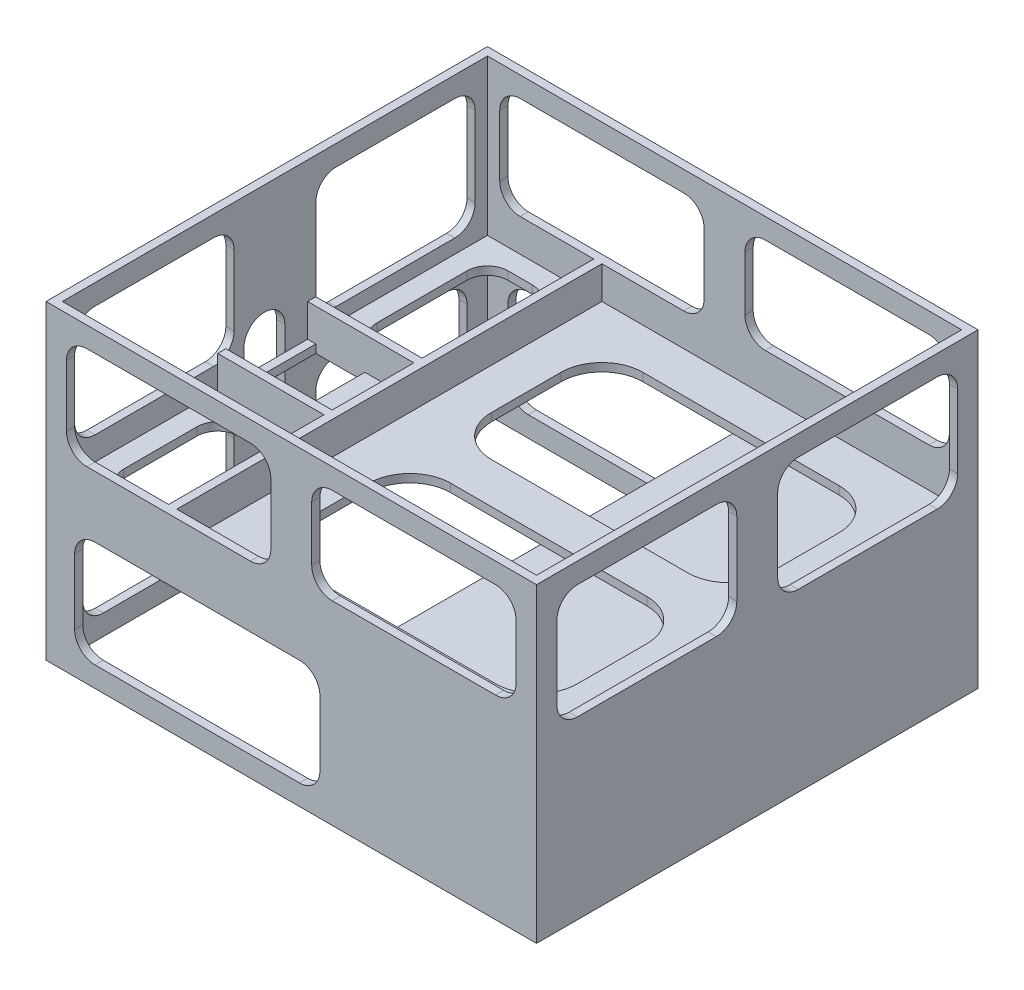
from build123d import *

# Parameters (mm, degrees)
SKETCH1_W                = 60
SKETCH1_H                = 54
BOSS_EXTRUDE1_DEPTH      = 38
SKETCH2_W                = 44
SKETCH2_H                = 52
CUT_EXTRUDE1_DEPTH       = 19
SKETCH3_W                = 35
SKETCH3_H                = 52
CUT_EXTRUDE2_DEPTH       = 18
SKETCH4_W                = 6
SKETCH4_H                = 10
CUT_EXTRUDE3_DEPTH       = 38
SKETCH5_W                = 14
SKETCH5_H                = 52
CUT_EXTRUDE5_DEPTH       = 15
SKETCH6_W                = 13
SKETCH6_H                = 52
CUT_EXTRUDE6_DEPTH       = 4
SKETCH8_W                = 15
SKETCH8_H                = 13
CUT_EXTRUDE7_DEPTH       = 6
SKETCH10_W               = 13
SKETCH10_H               = 5
CUT_EXTRUDE8_DEPTH       = 6
SKETCH11_W               = 4
SKETCH11_H               = 5
CUT_EXTRUDE9_DEPTH       = 3
SKETCH12_W               = 5
SKETCH12_H               = 2
CUT_EXTRUDE10_DEPTH      = 13
CUT_EXTRUDE11_DEPTH      = 1
SKETCH14_W               = 13
SKETCH14_H               = 1
BOSS_EXTRUDE2_DEPTH      = 4
SKETCH15_W               = 13
SKETCH15_H               = 1
BOSS_EXTRUDE3_DEPTH      = 4
CUT_EXTRUDE12_DEPTH      = 1
CUT_EXTRUDE13_DEPTH      = 1
CUT_EXTRUDE14_DEPTH      = 1
CUT_EXTRUDE15_DEPTH      = 60
CUT_EXTRUDE16_START      = -1
CUT_EXTRUDE16_DEPTH      = 1
CUT_EXTRUDE17_DEPTH      = 100
CUT_EXTRUDE17_DEPTH_BACK = 10
CUT_EXTRUDE18_DEPTH      = 10


with BuildPart() as part:
    # Sketch1 → Boss-Extrude1 (new body)
    with BuildSketch(Plane(origin=(0, 0, 0), x_dir=(1, 0, 0), z_dir=(0, 1, 0))):
        with Locations((-83.874465942, -33.946435202)):
            Rectangle(SKETCH1_W, SKETCH1_H)
    extrude(amount=BOSS_EXTRUDE1_DEPTH)

    # Sketch2 → Cut-Extrude1 (cut)
    with BuildSketch(Plane(origin=(0, 38, 0), x_dir=(1, 0, 0), z_dir=(0, 1, 0))):
        with Locations((-76.874465942, -33.946435202)):
            Rectangle(SKETCH2_W, SKETCH2_H)
    extrude(amount=-CUT_EXTRUDE1_DEPTH, mode=Mode.SUBTRACT)

    # Sketch3 → Cut-Extrude2 (cut)
    with BuildSketch(Plane(origin=(0, 0, 0), x_dir=(-1, 0, 0), z_dir=(0, -1, 0))):
        with Locations((95.374465942, -33.946435202)):
            Rectangle(SKETCH3_W, SKETCH3_H)
    extrude(amount=-CUT_EXTRUDE2_DEPTH, mode=Mode.SUBTRACT)

    # Sketch4 → Cut-Extrude3 (cut)
    with BuildSketch(Plane(origin=(0, 18, 0), x_dir=(-1, 0, 0), z_dir=(0, -1, 0))):
        with Locations((108.874465942, -34.946435202)):
            Rectangle(SKETCH4_W, SKETCH4_H)
    extrude(amount=-CUT_EXTRUDE3_DEPTH, mode=Mode.SUBTRACT)

    # Sketch5 → Cut-Extrude5 (cut)
    with BuildSketch(Plane(origin=(0, 38, 0), x_dir=(1, 0, 0), z_dir=(0, 1, 0))):
        with Locations((-105.874465942, -33.946435202)):
            Rectangle(SKETCH5_W, SKETCH5_H)
    extrude(amount=-CUT_EXTRUDE5_DEPTH, mode=Mode.SUBTRACT)

    # Sketch6 → Cut-Extrude6 (cut)
    with BuildSketch(Plane(origin=(0, 23, 0), x_dir=(1, 0, 0), z_dir=(0, 1, 0))):
        with Locations((-106.374465942, -33.946435202)):
            Rectangle(SKETCH6_W, SKETCH6_H)
    extrude(amount=-CUT_EXTRUDE6_DEPTH, mode=Mode.SUBTRACT)

    # Sketch8 → Cut-Extrude7 (cut)
    with BuildSketch(Plane(origin=(0, 0, 0), x_dir=(-1, 0, 0), z_dir=(0, -1, 0))):
        with Locations((65.874465942, -17.946435202)):
            Rectangle(SKETCH8_W, SKETCH8_H)
    extrude(amount=-CUT_EXTRUDE7_DEPTH, mode=Mode.SUBTRACT)

    # Sketch10 → Cut-Extrude8 (cut)
    with BuildSketch(Plane(origin=(-73.374465942, 0, 0), x_dir=(0, 0, -1), z_dir=(1, 0, 0))):
        with Locations((-17.946435202, 3.5)):
            Rectangle(SKETCH10_W, SKETCH10_H)
    extrude(amount=-CUT_EXTRUDE8_DEPTH, mode=Mode.SUBTRACT)

    # Sketch11 → Cut-Extrude9 (cut)
    with BuildSketch(Plane.XZ):
        with Locations((-65.874465942, 48.446435202)):
            Rectangle(SKETCH11_W, SKETCH11_H)
    extrude(amount=-CUT_EXTRUDE9_DEPTH, mode=Mode.SUBTRACT)

    # Sketch12 → Cut-Extrude10 (cut)
    with BuildSketch(Plane(origin=(-67.874465942, 0, 0), x_dir=(0, 0, -1), z_dir=(1, 0, 0))):
        with Locations((-48.446435202, 2)):
            Rectangle(SKETCH12_W, SKETCH12_H)
    extrude(amount=-CUT_EXTRUDE10_DEPTH, mode=Mode.SUBTRACT)

    # Sketch13 → Cut-Extrude11 (cut)
    with BuildSketch(Plane.ZY.offset(113.874465942)):
        with BuildLine():
            Line((32.733045904, 15), (32.733045904, 22))
            ThreePointArc((32.733045904, 22), (35.233045904, 24.5), (37.733045904, 22))
            Line((37.733045904, 22), (37.733045904, 15))
            ThreePointArc((37.733045904, 15), (35.233045904, 12.5), (32.733045904, 15))
        make_face()
    extrude(amount=-CUT_EXTRUDE11_DEPTH, mode=Mode.SUBTRACT)

    # Sketch14 → Boss-Extrude2 (add)
    with BuildSketch(Plane(origin=(0, 19, 0), x_dir=(1, 0, 0), z_dir=(0, 1, 0))):
        with Locations((-106.374465942, -40.446435202)):
            Rectangle(SKETCH14_W, SKETCH14_H)
    extrude(amount=BOSS_EXTRUDE2_DEPTH)

    # Sketch15 → Boss-Extrude3 (add)
    with BuildSketch(Plane(origin=(0, 19, 0), x_dir=(1, 0, 0), z_dir=(0, 1, 0))):
        with Locations((-106.374465942, -29.446435202)):
            Rectangle(SKETCH15_W, SKETCH15_H)
    extrude(amount=BOSS_EXTRUDE3_DEPTH)

    # Sketch16 → Cut-Extrude12 (cut)
    with BuildSketch(Plane(origin=(0, 19, 0), x_dir=(1, 0, 0), z_dir=(0, 1, 0))):
        with BuildLine():
            Line((-64.874465942, -54.946435202), (-88.874465942, -54.946435202))
            ThreePointArc((-88.874465942, -54.946435202), (-92.409999848, -53.481969108), (-93.874465942, -49.946435202))
            Line((-93.874465942, -49.946435202), (-93.874465942, -41.446435202))
            ThreePointArc((-93.874465942, -41.446435202), (-92.409999848, -37.910901296), (-88.874465942, -36.446435202))
            Line((-88.874465942, -36.446435202), (-64.874465942, -36.446435202))
            ThreePointArc((-64.874465942, -36.446435202), (-61.338932037, -37.910901296), (-59.874465942, -41.446435202))
            Line((-59.874465942, -41.446435202), (-59.874465942, -49.946435202))
            ThreePointArc((-59.874465942, -49.946435202), (-61.338932037, -53.481969108), (-64.874465942, -54.946435202))
        make_face()
        with BuildLine():
            Line((-88.874465942, -31.446435202), (-64.874465942, -31.446435202))
            ThreePointArc((-64.874465942, -31.446435202), (-61.338932037, -29.981969108), (-59.874465942, -26.446435202))
            Line((-59.874465942, -26.446435202), (-59.874465942, -17.946435202))
            ThreePointArc((-59.874465942, -17.946435202), (-61.338932037, -14.410901296), (-64.874465942, -12.946435202))
            Line((-64.874465942, -12.946435202), (-88.874465942, -12.946435202))
            ThreePointArc((-88.874465942, -12.946435202), (-92.409999848, -14.410901296), (-93.874465942, -17.946435202))
            Line((-93.874465942, -17.946435202), (-93.874465942, -26.446435202))
            ThreePointArc((-93.874465942, -26.446435202), (-92.409999848, -29.981969108), (-88.874465942, -31.446435202))
        make_face()
    extrude(amount=-CUT_EXTRUDE12_DEPTH, mode=Mode.SUBTRACT)

    # Sketch17 → Cut-Extrude13 (cut)
    with BuildSketch(Plane(origin=(0, 19, 0), x_dir=(1, 0, 0), z_dir=(0, 1, 0))):
        with BuildLine():
            Line((-104.874465942, -57.446435202), (-107.874465942, -57.446435202))
            ThreePointArc((-107.874465942, -57.446435202), (-109.642232895, -56.714202155), (-110.374465942, -54.946435202))
            Line((-110.374465942, -54.946435202), (-110.374465942, -45.946435202))
            ThreePointArc((-110.374465942, -45.946435202), (-109.642232895, -44.178668249), (-107.874465942, -43.446435202))
            Line((-107.874465942, -43.446435202), (-104.874465942, -43.446435202))
            ThreePointArc((-104.874465942, -43.446435202), (-103.10669899, -44.178668249), (-102.374465942, -45.946435202))
            Line((-102.374465942, -45.946435202), (-102.374465942, -54.946435202))
            ThreePointArc((-102.374465942, -54.946435202), (-103.10669899, -56.714202155), (-104.874465942, -57.446435202))
        make_face()
        with BuildLine():
            Line((-104.874465942, -26.446435202), (-107.874465942, -26.446435202))
            ThreePointArc((-107.874465942, -26.446435202), (-109.642232895, -25.714202155), (-110.374465942, -23.946435202))
            Line((-110.374465942, -23.946435202), (-110.374465942, -12.946435202))
            ThreePointArc((-110.374465942, -12.946435202), (-109.642232895, -11.178668249), (-107.874465942, -10.446435202))
            Line((-107.874465942, -10.446435202), (-104.874465942, -10.446435202))
            ThreePointArc((-104.874465942, -10.446435202), (-103.10669899, -11.178668249), (-102.374465942, -12.946435202))
            Line((-102.374465942, -12.946435202), (-102.374465942, -23.946435202))
            ThreePointArc((-102.374465942, -23.946435202), (-103.10669899, -25.714202155), (-104.874465942, -26.446435202))
        make_face()
    extrude(amount=-CUT_EXTRUDE13_DEPTH, mode=Mode.SUBTRACT)

    # Sketch18 → Cut-Extrude14 (cut)
    with BuildSketch(Plane(origin=(-53.874465942, 0, 0), x_dir=(0, 0, -1), z_dir=(1, 0, 0))):
        with BuildLine():
            Line((-55.946435202, 35.5), (-38.946435202, 35.5))
            ThreePointArc((-38.946435202, 35.5), (-37.178668249, 34.767766953), (-36.446435202, 33))
            Line((-36.446435202, 33), (-36.446435202, 24))
            ThreePointArc((-36.446435202, 24), (-37.178668249, 22.232233047), (-38.946435202, 21.5))
            Line((-38.946435202, 21.5), (-55.946435202, 21.5))
            ThreePointArc((-55.946435202, 21.5), (-57.714202155, 22.232233047), (-58.446435202, 24))
            Line((-58.446435202, 24), (-58.446435202, 33))
            ThreePointArc((-58.446435202, 33), (-57.714202155, 34.767766953), (-55.946435202, 35.5))
        make_face()
        with BuildLine():
            Line((-28.946435202, 35.5), (-11.946435202, 35.5))
            ThreePointArc((-11.946435202, 35.5), (-10.178668249, 34.767766953), (-9.446435202, 33))
            Line((-9.446435202, 33), (-9.446435202, 24))
            ThreePointArc((-9.446435202, 24), (-10.178668249, 22.232233047), (-11.946435202, 21.5))
            Line((-11.946435202, 21.5), (-28.946435202, 21.5))
            ThreePointArc((-28.946435202, 21.5), (-30.714202155, 22.232233047), (-31.446435202, 24))
            Line((-31.446435202, 24), (-31.446435202, 33))
            ThreePointArc((-31.446435202, 33), (-30.714202155, 34.767766953), (-28.946435202, 35.5))
        make_face()
    extrude(amount=-CUT_EXTRUDE14_DEPTH, mode=Mode.SUBTRACT)

    # Sketch19 → Cut-Extrude15 (cut)
    with BuildSketch(Plane(origin=(0, 0, 6.946435202), x_dir=(-1, 0, 0), z_dir=(0, 0, -1))):
        with BuildLine():
            Line((58.874465942, 35.5), (78.874465942, 35.5))
            ThreePointArc((78.874465942, 35.5), (80.642232895, 34.767766953), (81.374465942, 33))
            Line((81.374465942, 33), (81.374465942, 26.304053451))
            ThreePointArc((81.374465942, 26.304053451), (80.642232895, 24.536286498), (78.874465942, 23.804053451))
            Line((78.874465942, 23.804053451), (58.874465942, 23.804053451))
            ThreePointArc((58.874465942, 23.804053451), (57.10669899, 24.536286498), (56.374465942, 26.304053451))
            Line((56.374465942, 26.304053451), (56.374465942, 33))
            ThreePointArc((56.374465942, 33), (57.10669899, 34.767766953), (58.874465942, 35.5))
        make_face()
        with BuildLine():
            Line((88.874465942, 35.5), (108.874465942, 35.5))
            ThreePointArc((108.874465942, 35.5), (110.642232895, 34.767766953), (111.374465942, 33))
            Line((111.374465942, 33), (111.374465942, 25.5))
            ThreePointArc((111.374465942, 25.5), (110.642232895, 23.732233047), (108.874465942, 23))
            Line((108.874465942, 23), (88.874465942, 23))
            ThreePointArc((88.874465942, 23), (87.10669899, 23.732233047), (86.374465942, 25.5))
            Line((86.374465942, 25.5), (86.374465942, 33))
            ThreePointArc((86.374465942, 33), (87.10669899, 34.767766953), (88.874465942, 35.5))
        make_face()
    extrude(amount=-CUT_EXTRUDE15_DEPTH, mode=Mode.SUBTRACT)

    # Sketch20 → Cut-Extrude16 (cut)
    with BuildSketch(Plane.ZY.offset(113.874465942).offset(CUT_EXTRUDE16_START)):
        with BuildLine():
            Line((11.946435202, 35.5), (26.446435202, 35.5))
            ThreePointArc((26.446435202, 35.5), (28.214202155, 34.767766953), (28.946435202, 33))
            Line((28.946435202, 33), (28.946435202, 23.221982389))
            ThreePointArc((28.946435202, 23.221982389), (28.214202155, 21.454215436), (26.446435202, 20.721982389))
            Line((26.446435202, 20.721982389), (11.946435202, 20.721982389))
            ThreePointArc((11.946435202, 20.721982389), (10.178668249, 21.454215436), (9.446435202, 23.221982389))
            Line((9.446435202, 23.221982389), (9.446435202, 33))
            ThreePointArc((9.446435202, 33), (10.178668249, 34.767766953), (11.946435202, 35.5))
        make_face()
        with BuildLine():
            Line((41.446435202, 35.5), (55.946435202, 35.5))
            ThreePointArc((55.946435202, 35.5), (57.714202155, 34.767766953), (58.446435202, 33))
            Line((58.446435202, 33), (58.446435202, 24.375603128))
            ThreePointArc((58.446435202, 24.375603128), (57.714202155, 22.607836175), (55.946435202, 21.875603128))
            Line((55.946435202, 21.875603128), (41.446435202, 21.875603128))
            ThreePointArc((41.446435202, 21.875603128), (39.678668249, 22.607836175), (38.946435202, 24.375603128))
            Line((38.946435202, 24.375603128), (38.946435202, 33))
            ThreePointArc((38.946435202, 33), (39.678668249, 34.767766953), (41.446435202, 35.5))
        make_face()
    extrude(amount=CUT_EXTRUDE16_DEPTH, mode=Mode.SUBTRACT)

    # Sketch21 → Cut-Extrude17 (cut, two sides: drawn at the far end of the back side and taken through both)
    with BuildSketch(Plane(origin=(0, 0, 59.946435202), x_dir=(-1, 0, 0), z_dir=(0, 0, -1)).offset(-CUT_EXTRUDE17_DEPTH_BACK)):
        with BuildLine():
            Line((107.874465942, 2.5), (82.874465942, 2.5))
            ThreePointArc((82.874465942, 2.5), (81.10669899, 3.232233047), (80.374465942, 5))
            Line((80.374465942, 5), (80.374465942, 13))
            ThreePointArc((80.374465942, 13), (81.10669899, 14.767766953), (82.874465942, 15.5))
            Line((82.874465942, 15.5), (107.874465942, 15.5))
            ThreePointArc((107.874465942, 15.5), (109.642232895, 14.767766953), (110.374465942, 13))
            Line((110.374465942, 13), (110.374465942, 5))
            ThreePointArc((110.374465942, 5), (109.642232895, 3.232233047), (107.874465942, 2.5))
        make_face()
    extrude(amount=CUT_EXTRUDE17_DEPTH + CUT_EXTRUDE17_DEPTH_BACK, mode=Mode.SUBTRACT)

    # Sketch22 → Cut-Extrude18 (cut)
    with BuildSketch(Plane(origin=(-112.874465942, 0, 0), x_dir=(0, 0, -1), z_dir=(1, 0, 0))):
        with BuildLine():
            Line((-12.946435202, 2.5), (-26.446435202, 2.5))
            ThreePointArc((-26.446435202, 2.5), (-28.214202155, 3.232233047), (-28.946435202, 5))
            Line((-28.946435202, 5), (-28.946435202, 13))
            ThreePointArc((-28.946435202, 13), (-28.214202155, 14.767766953), (-26.446435202, 15.5))
            Line((-26.446435202, 15.5), (-12.946435202, 15.5))
            ThreePointArc((-12.946435202, 15.5), (-11.178668249, 14.767766953), (-10.446435202, 13))
            Line((-10.446435202, 13), (-10.446435202, 5))
            ThreePointArc((-10.446435202, 5), (-11.178668249, 3.232233047), (-12.946435202, 2.5))
        make_face()
        with BuildLine():
            Line((-41.446435202, 2.5), (-54.946435202, 2.5))
            ThreePointArc((-54.946435202, 2.5), (-56.714202155, 3.232233047), (-57.446435202, 5))
            Line((-57.446435202, 5), (-57.446435202, 13))
            ThreePointArc((-57.446435202, 13), (-56.714202155, 14.767766953), (-54.946435202, 15.5))
            Line((-54.946435202, 15.5), (-41.446435202, 15.5))
            ThreePointArc((-41.446435202, 15.5), (-39.678668249, 14.767766953), (-38.946435202, 13))
            Line((-38.946435202, 13), (-38.946435202, 5))
            ThreePointArc((-38.946435202, 5), (-39.678668249, 3.232233047), (-41.446435202, 2.5))
        make_face()
    extrude(amount=-CUT_EXTRUDE18_DEPTH, mode=Mode.SUBTRACT)


solid = part.part
